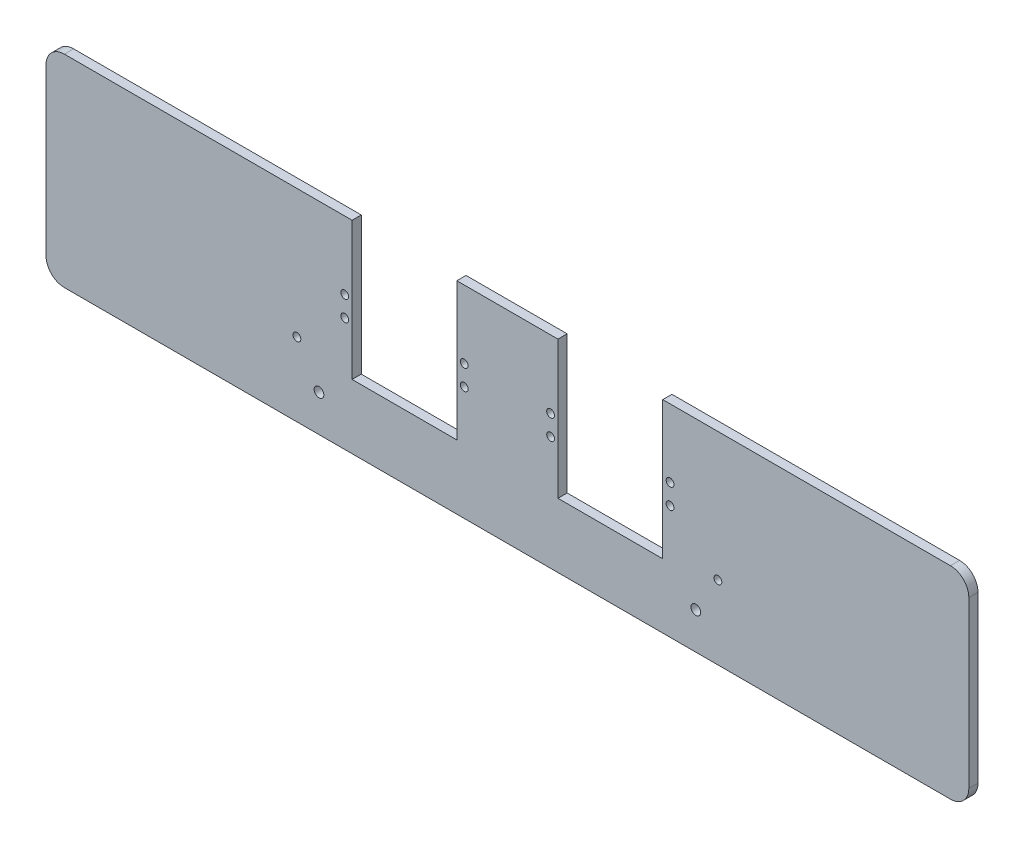
from build123d import *

# Parameters (mm, degrees)
BOSS_EXTRUDE1_DEPTH = 5
SKETCH3_R           = 2.125
CUT_EXTRUDE1_DEPTH  = 10
FILLET1_R           = 10
SKETCH4_R           = 2.65
CUT_EXTRUDE2_DEPTH  = 10
SKETCH5_R           = 2.125
CUT_EXTRUDE3_DEPTH  = 10


with BuildPart() as part:
    # Sketch1 → Boss-Extrude1 (new body)
    with BuildSketch(Plane.XY):
        Polygon((0, 0), (0, 110), (166.5, 110), (166.5, 35), (223.5, 35), (223.5, 110), (278.5, 110), (278.5, 35), (335.5, 35), (335.5, 110), (502, 110), (502, 0), align=None)
    extrude(amount=BOSS_EXTRUDE1_DEPTH)

    # Sketch3 → Cut-Extrude1 (cut)
    with BuildSketch(Plane.XY.offset(5)):
        with Locations((162.5, 73)):
            Circle(SKETCH3_R)
        with Locations((162.5, 62)):
            Circle(SKETCH3_R)
        with Locations(Location((227.5, 62, 0), (0, 0, 180))):
            Circle(SKETCH3_R)
        with Locations(Location((227.5, 73, 0), (0, 0, 180))):
            Circle(SKETCH3_R)
        with Locations((274.5, 73)):
            Circle(SKETCH3_R)
        with Locations((274.5, 62)):
            Circle(SKETCH3_R)
        with Locations(Location((339.5, 62, 0), (0, 0, 180))):
            Circle(SKETCH3_R)
        with Locations(Location((339.5, 73, 0), (0, 0, 180))):
            Circle(SKETCH3_R)
    extrude(amount=-CUT_EXTRUDE1_DEPTH, mode=Mode.SUBTRACT)

    # Fillet1
    fillet1_edges = [part.edges().sort_by_distance(p)[0] for p in [
        (0, 0, 2.5),
        (0, 110, 2.5),
        (502, 110, 2.5),
        (502, 0, 2.5),
    ]]
    fillet(fillet1_edges, radius=FILLET1_R)

    # Sketch4 → Cut-Extrude2 (cut)
    with BuildSketch(Plane.XY.offset(5)):
        with Locations((148.5, 20)):
            Circle(SKETCH4_R)
        with Locations(Location((353.5, 20, 0), (0, 0, 180))):
            Circle(SKETCH4_R)
    extrude(amount=-CUT_EXTRUDE2_DEPTH, mode=Mode.SUBTRACT)

    # Sketch5 → Cut-Extrude3 (cut)
    with BuildSketch(Plane.XY.offset(5)):
        with Locations((365.5, 40)):
            Circle(SKETCH5_R)
        with Locations(Location((136.5, 40, 0), (0, 0, 180))):
            Circle(SKETCH5_R)
    extrude(amount=-CUT_EXTRUDE3_DEPTH, mode=Mode.SUBTRACT)


solid = part.part
